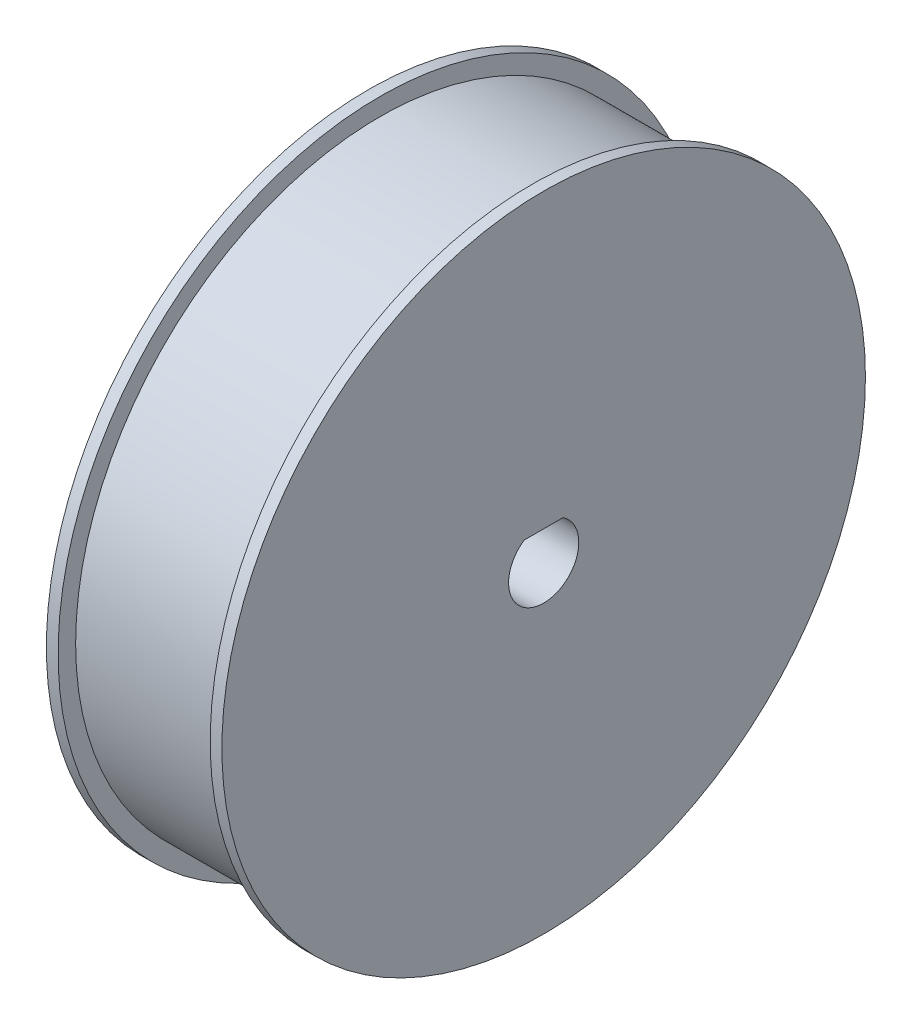
from build123d import *

# Parameters (mm, degrees)
BASE_DEPTH           = 10
BASE_DEPTH_BACK      = 5
ESQUISSE1_R          = 27.5
VIDE_PNEU_DEPTH      = 9
VIDE_PNEU_DEPTH_BACK = 4
ESQUISSE4_R          = 27.5
ESQUISSE4_R_2        = 26


with BuildPart() as part:
    # Esquisse1 → BASE (new, two sides: drawn at the far end of the back side and taken through both)
    with BuildSketch(Plane(origin=(0, 0, 0), x_dir=(0, 0, -1), z_dir=(1, 0, 0)).offset(-BASE_DEPTH_BACK)):
        Circle(ESQUISSE1_R)
        with BuildLine():
            Line((-1.658312395, 2.5), (1.658312395, 2.5))
            ThreePointArc((1.658312395, 2.5), (0, -3), (-1.658312395, 2.5))
        make_face(mode=Mode.SUBTRACT)
    extrude(amount=BASE_DEPTH + BASE_DEPTH_BACK)

    # Esquisse4 → VIDE PNEU (cut, two sides: drawn at the far end of the back side and taken through both)
    with BuildSketch(Plane(origin=(0, 0, 0), x_dir=(0, 0, -1), z_dir=(1, 0, 0)).offset(-VIDE_PNEU_DEPTH_BACK)):
        Circle(ESQUISSE4_R)
        Circle(ESQUISSE4_R_2, mode=Mode.SUBTRACT)
    extrude(amount=VIDE_PNEU_DEPTH + VIDE_PNEU_DEPTH_BACK, mode=Mode.SUBTRACT)


solid = part.part
